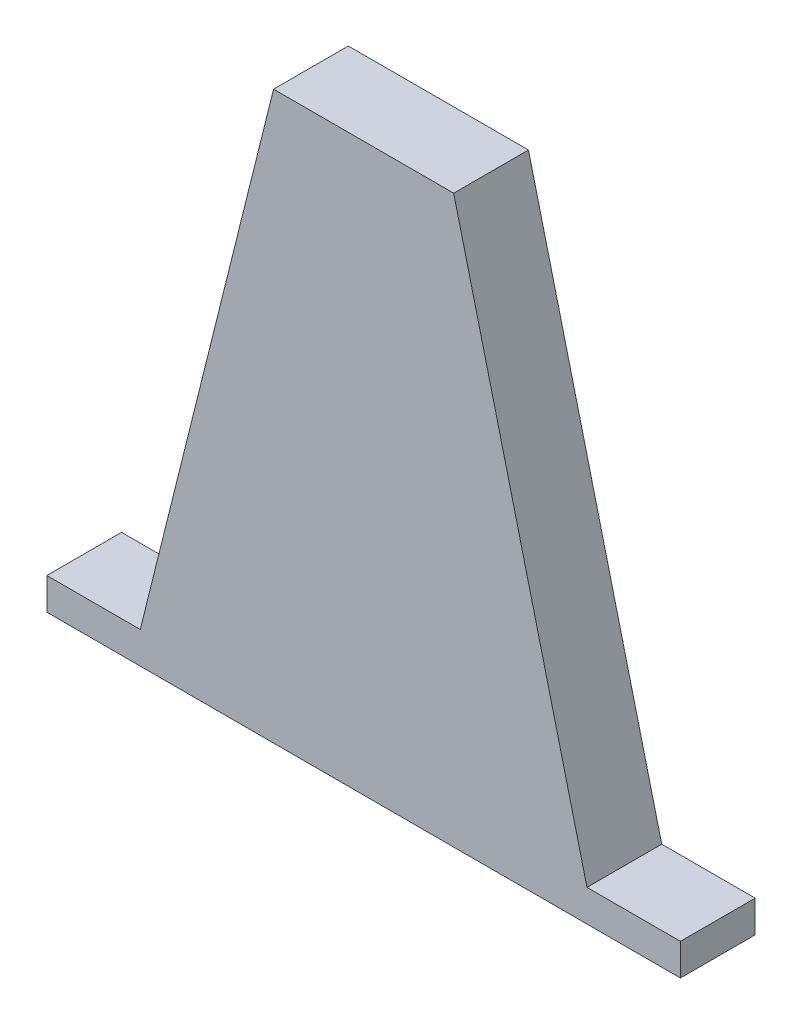
from build123d import *

# Parameters (mm, degrees)
BOSS_EXTRUDE1_DEPTH = 20


with BuildPart() as part:
    # Sketch1 → Boss-Extrude1 (new body)
    with BuildSketch(Plane.XY):
        Polygon((-85.5, -68), (-60.5, -68), (-24.846095593, 75), (23.346095593, 75), (59, -68), (84, -68), (84, -76.5), (-85.5, -76.5), align=None)
    extrude(amount=BOSS_EXTRUDE1_DEPTH)


solid = part.part
